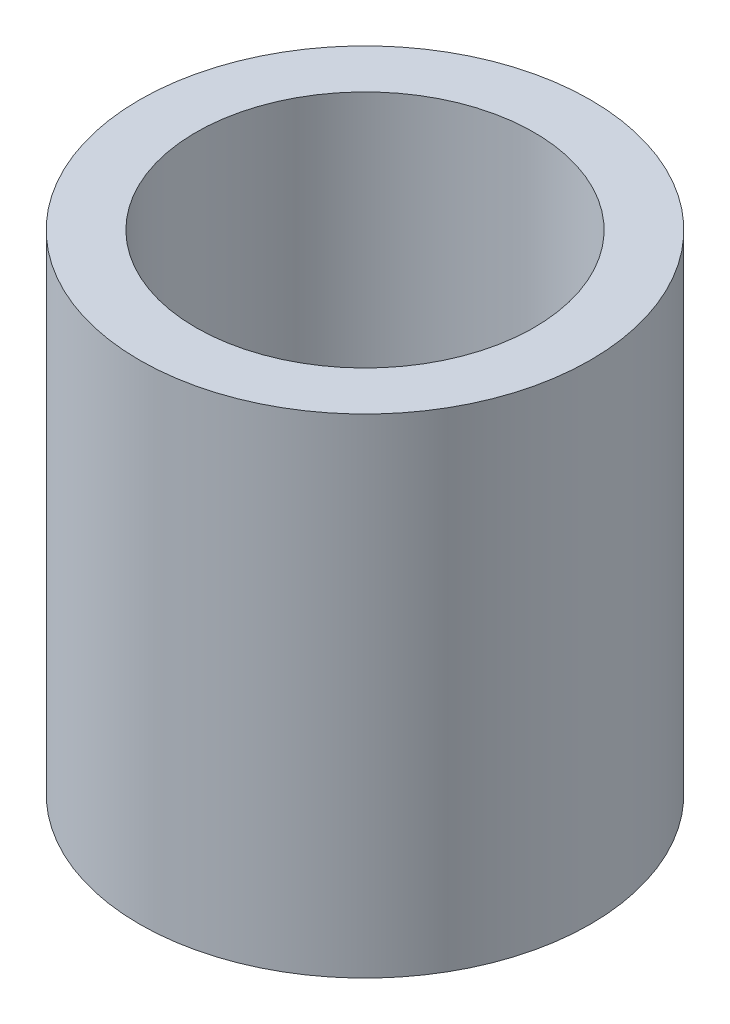
from build123d import *

# Parameters (mm, degrees)
BASE_EXTRUSION_DEPTH      = 3.25
BASE_EXTRUSION_DEPTH_BACK = 3.25
ESQUISSE2_R               = 3
ESQUISSE2_R_2             = 2.25


with BuildPart() as part:
    # Esquisse2 → Base-Extrusion (new, two sides: drawn at the far end of the back side and taken through both)
    with BuildSketch(Plane(origin=(0, 0, 0), x_dir=(-1, 0, 0), z_dir=(0, 1, 0)).offset(-BASE_EXTRUSION_DEPTH_BACK)):
        with Locations(Location((30, 0, 0), (0, 0, 90))):
            Circle(ESQUISSE2_R)
        with Locations(Location((30, 0, 0), (0, 0, 90))):
            Circle(ESQUISSE2_R_2, mode=Mode.SUBTRACT)
    extrude(amount=BASE_EXTRUSION_DEPTH + BASE_EXTRUSION_DEPTH_BACK)


solid = part.part
